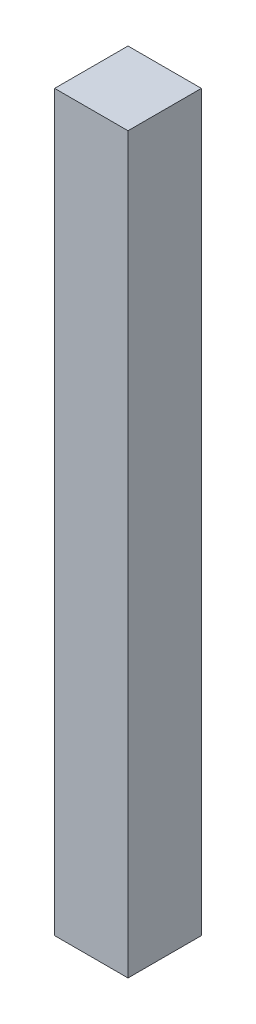
from build123d import *

# Parameters (mm, degrees)
SKETCH1_W           = 50.8
SKETCH1_H           = 50.8
BOSS_EXTRUDE1_DEPTH = 508


with BuildPart() as part:
    # Sketch1 → Boss-Extrude1 (new body)
    with BuildSketch(Plane(origin=(0, 0, 0), x_dir=(1, 0, 0), z_dir=(0, 1, 0))):
        Rectangle(SKETCH1_W, SKETCH1_H)
    extrude(amount=BOSS_EXTRUDE1_DEPTH)


solid = part.part
